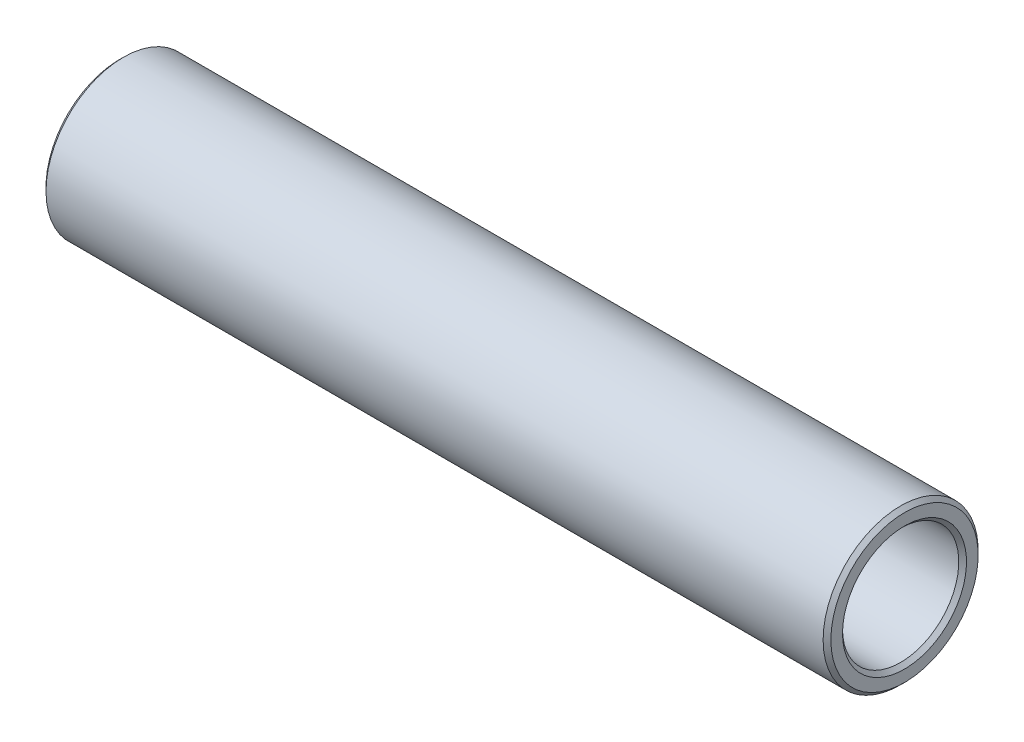
from build123d import *

# Parameters (mm, degrees)
SKETCH1_W     = 40.5
SKETCH1_H     = 1
CHAMFER1_SIZE = 0.2


with BuildPart() as part:
    # Sketch1 → Revolve1 (revolve)
    with BuildSketch(Plane.XY):
        with Locations((20.25, 3.5)):
            Rectangle(SKETCH1_W, SKETCH1_H)
    revolve(axis=Axis((0, 0, 0), (1, 0, 0)))

    # Chamfer1
    chamfer1_edges = [part.edges().sort_by_distance(p)[0] for p in [
        (0, -3, 0),
        (0, -4, 0),
        (40.5, -3, 0),
        (40.5, -4, 0),
    ]]
    chamfer(chamfer1_edges, length=CHAMFER1_SIZE)


solid = part.part
